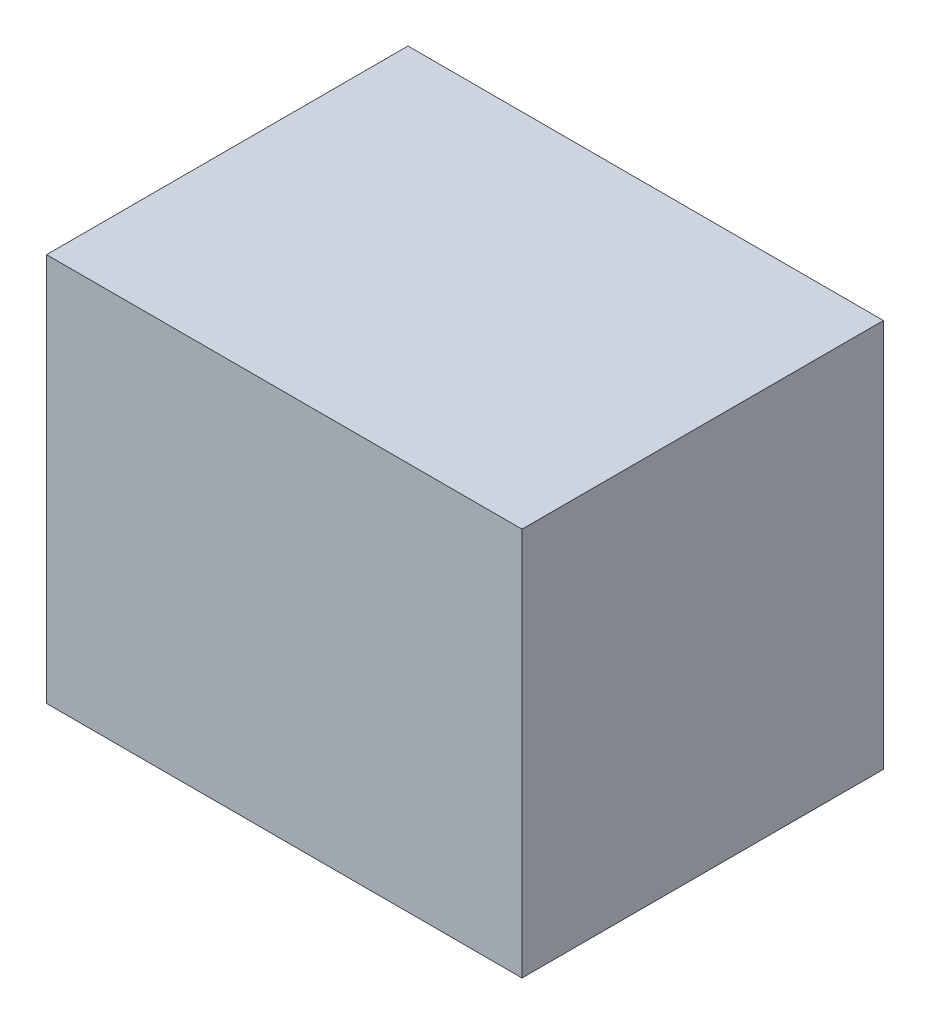
from build123d import *

# Parameters (mm, degrees)
SKETCH1_W           = 296
SKETCH1_H           = 225
BOSS_EXTRUDE1_DEPTH = 242


with BuildPart() as part:
    # Sketch1 → Boss-Extrude1 (new body)
    with BuildSketch(Plane(origin=(0, 0, 0), x_dir=(1, 0, 0), z_dir=(0, 1, 0))):
        with Locations((66.28774777, -43.40244481)):
            Rectangle(SKETCH1_W, SKETCH1_H)
    extrude(amount=BOSS_EXTRUDE1_DEPTH)


solid = part.part
